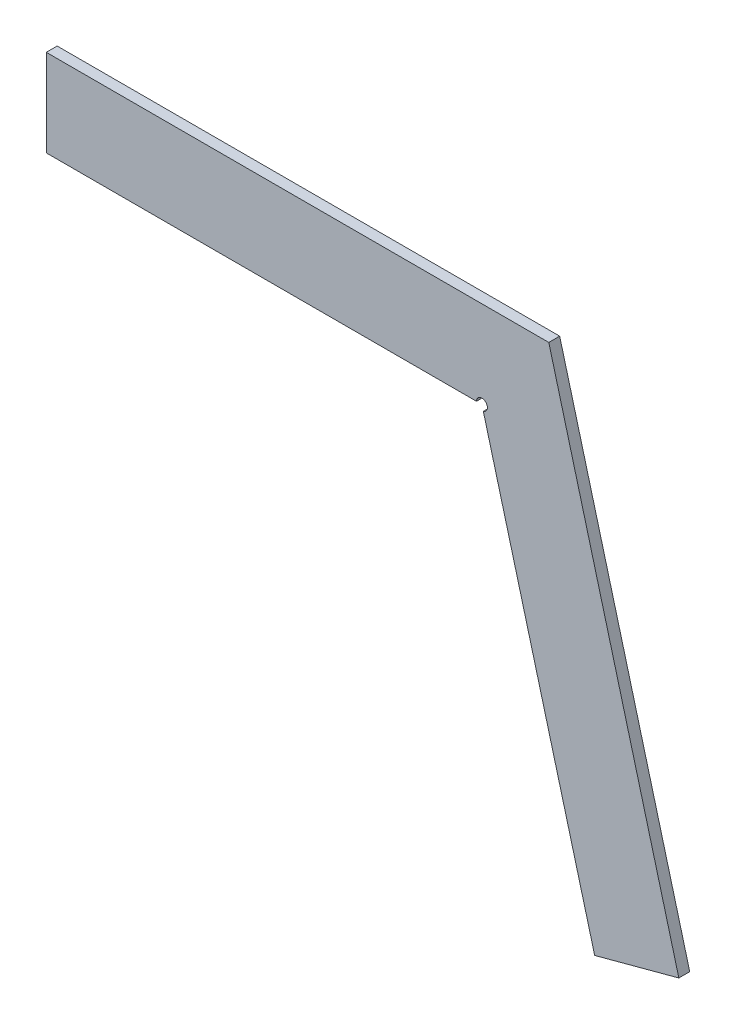
from build123d import *

# Parameters (mm, degrees)
BOSS_EXTRU_1_DEPTH      = 5
ESQUISSE2_R             = 2.5
ENL_V_MAT_EXTRU_1_DEPTH = 373.468750867


with BuildPart() as part:
    # Esquisse1 → Boss.-Extru.1 (new body)
    with BuildSketch(Plane.XY):
        Polygon((0, 0), (0, -40), (200, -40), (251.763809021, -233.185165258), (290.400842072, -222.832403454), (230.693079519, 0), align=None)
    extrude(amount=BOSS_EXTRU_1_DEPTH)

    # Esquisse2 → Enlèv. mat.-Extru.1 (cut, through all)
    with BuildSketch(Plane.XY.offset(5)):
        with Locations((200, -40)):
            Circle(ESQUISSE2_R)
    extrude(amount=-ENL_V_MAT_EXTRU_1_DEPTH, mode=Mode.SUBTRACT)


solid = part.part
